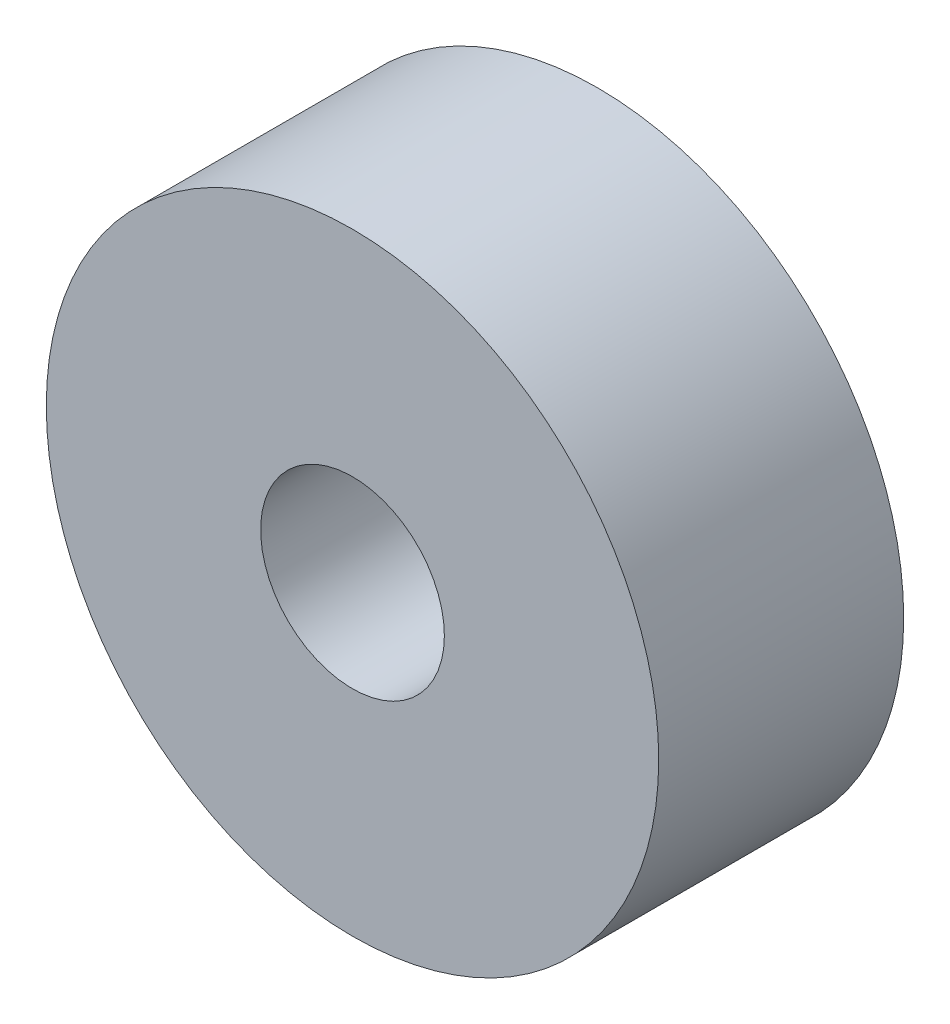
from build123d import *

# Parameters (mm, degrees)
SKETCH_1_R        = 5
SKETCH_1_R_2      = 1.5
EXTRUDE_311_DEPTH = 2


with BuildPart() as part:
    # Эскиз1 → Extrude 311 (new, symmetric)
    with BuildSketch(Plane.XY):
        Circle(SKETCH_1_R)
        Circle(SKETCH_1_R_2, mode=Mode.SUBTRACT)
    extrude(amount=EXTRUDE_311_DEPTH, both=True)


solid = part.part
